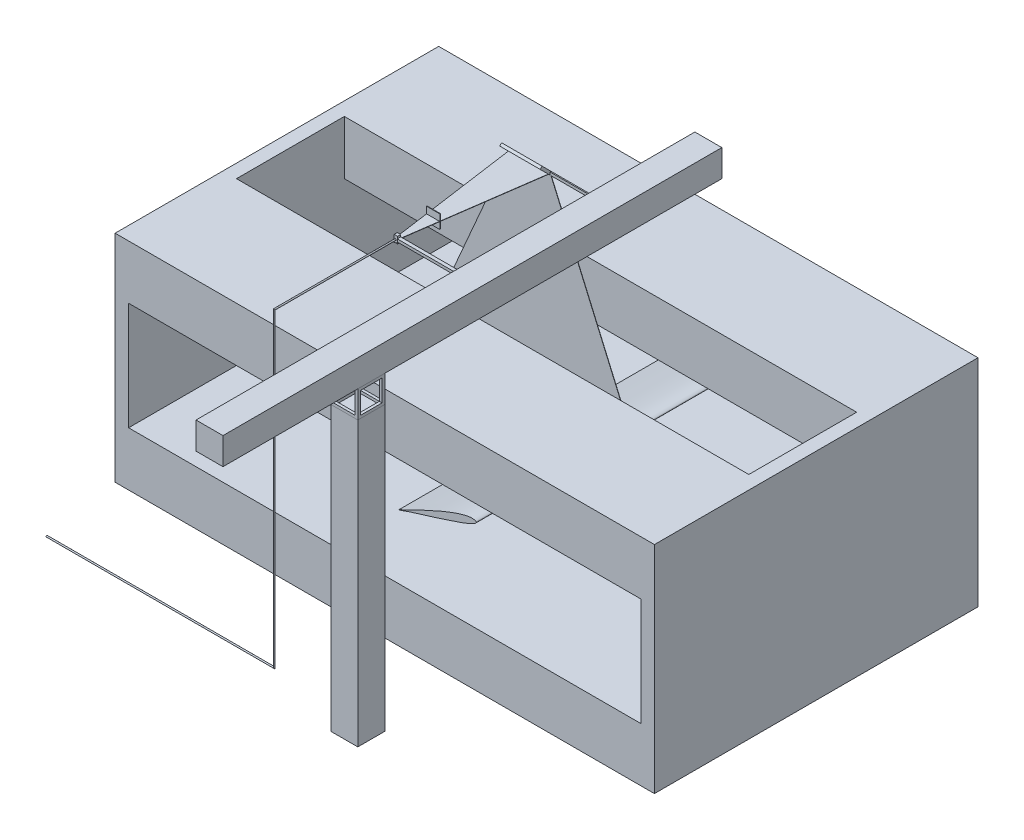
from build123d import *

# Parameters (mm, degrees)
SKETCH1_W                 = 2000
SKETCH1_H                 = 800
BOSS_EXTRUDE1_DEPTH       = 1200
CUT_EXTRUDE1_DEPTH        = 1613.45154966
CUT_EXTRUDE1_DEPTH_BACK   = 1613.45154966
SKETCH2_W                 = 1900
SKETCH2_H                 = 400
SKETCH3_W                 = 1900
SKETCH3_H                 = 400
CUT_EXTRUDE3_DEPTH        = 200
BOSS_EXTRUDE2_DEPTH       = 50
BOSS_EXTRUDE2_DEPTH_BACK  = 50
SKETCH5_W                 = 100
SKETCH5_H                 = 1050
SKETCH6_W                 = 100
SKETCH6_H                 = 100
SKETCH6_W_2               = 80
SKETCH6_H_2               = 80
BOSS_EXTRUDE3_DEPTH       = 100
CUT_EXTRUDE4_DEPTH        = 2031.394050425
CUT_EXTRUDE4_DEPTH_BACK   = 2031.394050425
SKETCH7_W                 = 80
SKETCH7_H                 = 80
CUT_EXTRUDE6_DEPTH        = 2137.000936329
CUT_EXTRUDE6_DEPTH_BACK   = 2137.000936329
SKETCH8_W                 = 80
SKETCH8_H                 = 80
SKETCH9_W                 = 1850
SKETCH9_H                 = 100
BOSS_EXTRUDE4_DEPTH       = 100
BOSS_EXTRUDE5_DEPTH       = 5
BOSS_EXTRUDE5_DEPTH_BACK  = 5
SKETCH12_W                = 150
SKETCH12_H                = 100
SKETCH13_R                = 2.5
SKETCH14_W                = 12.7
SKETCH14_H                = 25
BOSS_EXTRUDE6_DEPTH       = 12.7
CUT_EXTRUDE7_START        = -612.5
CUT_EXTRUDE7_DEPTH        = 612.5
BOSS_EXTRUDE7_DEPTH       = 0.5
BOSS_EXTRUDE7_DEPTH_BACK  = 0.5
BOSS_EXTRUDE9_REACH       = 2484.484
SKETCH18_W                = 4.142135624
SKETCH18_H                = 10
BOSS_EXTRUDE10_REACH      = 2500.535
SKETCH19_W                = 12.7
SKETCH19_H                = 10
AIRFOIL_DEPTH             = 500
AIRFOIL_DEPTH_BACK        = 500
BOSS_EXTRUDE12_DEPTH      = 1
BOSS_EXTRUDE12_DEPTH_BACK = 1
SKETCH22_W                = 50
SKETCH22_H                = 50
BOSS_EXTRUDE13_REACH      = 2513.917
LASERSHEET_DEPTH          = 0.5
LASERSHEET_DEPTH_BACK     = 0.5


with BuildPart() as part:
    # Sketch1 → Boss-Extrude1 (new body)
    with BuildSketch(Plane.XY):
        Rectangle(SKETCH1_W, SKETCH1_H)
    extrude(amount=BOSS_EXTRUDE1_DEPTH)

    # Sketch2 → Cut-Extrude1 (cut, two sides: drawn at the far end of the back side and taken through both)
    with BuildSketch(Plane.XY.offset(1200).offset(-CUT_EXTRUDE1_DEPTH_BACK)):
        Rectangle(SKETCH2_W, SKETCH2_H)
    extrude(amount=CUT_EXTRUDE1_DEPTH + CUT_EXTRUDE1_DEPTH_BACK, mode=Mode.SUBTRACT)

    # Sketch3 → Cut-Extrude3 (cut)
    with BuildSketch(Plane(origin=(0, 400, 0), x_dir=(1, 0, 0), z_dir=(0, 1, 0))):
        with Locations((0, -600)):
            Rectangle(SKETCH3_W, SKETCH3_H)
    extrude(amount=-CUT_EXTRUDE3_DEPTH, mode=Mode.SUBTRACT)


with BuildPart() as body_2:
    # Sketch5 → Boss-Extrude2 (new, two sides: drawn at the far end of the back side and taken through both)
    with BuildSketch(Plane.ZY.offset(-250).offset(-BOSS_EXTRUDE2_DEPTH_BACK)):
        with Locations((1550, 125)):
            Rectangle(SKETCH5_W, SKETCH5_H)
    extrude(amount=BOSS_EXTRUDE2_DEPTH + BOSS_EXTRUDE2_DEPTH_BACK)


with BuildPart() as body_3:
    # Sketch6 → Boss-Extrude3 (new body)
    with BuildSketch(Plane(origin=(0, 650, 0), x_dir=(1, 0, 0), z_dir=(0, 1, 0))):
        with Locations((250, -1550)):
            Rectangle(SKETCH6_W, SKETCH6_H)
        with Locations((250, -1550)):
            Rectangle(SKETCH6_W_2, SKETCH6_H_2, mode=Mode.SUBTRACT)
    extrude(amount=BOSS_EXTRUDE3_DEPTH)

    # Sketch7 → Cut-Extrude4 (cut, two sides: drawn at the far end of the back side and taken through both)
    with BuildSketch(Plane.XY.offset(1600).offset(-CUT_EXTRUDE4_DEPTH_BACK)):
        with Locations((250, 700)):
            Rectangle(SKETCH7_W, SKETCH7_H)
    extrude(amount=CUT_EXTRUDE4_DEPTH + CUT_EXTRUDE4_DEPTH_BACK, mode=Mode.SUBTRACT)

    # Sketch8 → Cut-Extrude6 (cut, two sides: drawn at the far end of the back side and taken through both)
    with BuildSketch(Plane.ZY.offset(-200).offset(-CUT_EXTRUDE6_DEPTH_BACK)):
        with Locations((1550, 700)):
            Rectangle(SKETCH8_W, SKETCH8_H)
    extrude(amount=CUT_EXTRUDE6_DEPTH + CUT_EXTRUDE6_DEPTH_BACK, mode=Mode.SUBTRACT)


with BuildPart() as body_4:
    # Sketch9 → Boss-Extrude4 (new body)
    with BuildSketch(Plane.ZY.offset(-200)):
        with Locations((1175, 800)):
            Rectangle(SKETCH9_W, SKETCH9_H)
    extrude(amount=-BOSS_EXTRUDE4_DEPTH)

    # Sketch18 → Boss-Extrude9 (add, up to next)
    with BuildSketch(Plane(origin=(15, 0, 0), x_dir=(0, 0, -1), z_dir=(1, 0, 0)), mode=Mode.PRIVATE) as boss_extrude9_sk1:
        with Locations((-600, 800)):
            Rectangle(SKETCH18_W, SKETCH18_H)
    boss_extrude9_tool1 = extrude(boss_extrude9_sk1.sketch, amount=BOSS_EXTRUDE9_REACH, mode=Mode.PRIVATE) - body_4.part


with BuildPart() as body_5:
    # Sketch12 → Boss-Extrude5 (new, two sides: drawn at the far end of the back side and taken through both)
    with BuildSketch(Plane(origin=(0, 100, -100), x_dir=(-1, 0, 0), z_dir=(2.6947018836624807e-15, 0.7071067811865488, -0.7071067811865464)).offset(-BOSS_EXTRUDE5_DEPTH_BACK)):
        with Locations((60, 989.949493661)):
            Rectangle(SKETCH12_W, SKETCH12_H)
    extrude(amount=BOSS_EXTRUDE5_DEPTH + BOSS_EXTRUDE5_DEPTH_BACK)



with BuildPart() as body_6:
    # LaserBeam: sweep along a curve in space
    with BuildLine() as laserbeam_path:
        Line((-903.860382838, -350, 1550), (-60, -350, 1550))
        Line((-60, -350, 1550), (-60, 800, 1550))
        Line((-60, 800, 1550), (-60, 800, 1100))
    # Sketch13 → LaserBeam (sweep)
    with BuildSketch(Plane.ZY.offset(903.860382838)):
        with Locations((1550, -350)):
            Circle(SKETCH13_R)
    sweep(path=laserbeam_path.line, transition=Transition.RIGHT)


with BuildPart() as body_7:
    # Sketch14 → Boss-Extrude6 (new body)
    with BuildSketch(Plane(origin=(0, 0, 1100), x_dir=(-1, 0, 0), z_dir=(0, 0, -1))):
        with Locations((60, 800)):
            Rectangle(SKETCH14_W, SKETCH14_H)
    extrude(amount=BOSS_EXTRUDE6_DEPTH)


with BuildPart() as cut_extrude7_tool:
    # Sketch15 → Cut-Extrude7 (new body)
    with BuildSketch(Plane(origin=(0, 812.5, 0), x_dir=(1, 0, 0), z_dir=(0, 1, 0)).offset(CUT_EXTRUDE7_START)):
        with BuildLine():
            Line((-66.35, -1100), (-53.65, -1100))
            ThreePointArc((-53.65, -1100), (-60, -1098.26696336), (-66.35, -1100))
        make_face()
    extrude(amount=CUT_EXTRUDE7_DEPTH)


with BuildPart() as part_1:
    add(part.part)

    # Cut-Extrude7: cut by cut_extrude7_tool
    add(cut_extrude7_tool.part, mode=Mode.SUBTRACT)


with BuildPart() as body_7_1:
    add(body_7.part)

    # Cut-Extrude7: cut by cut_extrude7_tool
    add(cut_extrude7_tool.part, mode=Mode.SUBTRACT)


with BuildPart() as body_5_1:
    add(body_5.part)

    add(body_7_1.part)  # Boss-Extrude7 merges body 7
    # Sketch16 → Boss-Extrude7 (add, two sides: drawn at the far end of the back side and taken through both)
    with BuildSketch(Plane(origin=(0, 800, 0), x_dir=(1, 0, 0), z_dir=(0, 1, 0)).offset(-BOSS_EXTRUDE7_DEPTH_BACK)):
        Polygon((-53.65, -1087.3), (15, -600), (-135, -600), (-66.35, -1087.3), align=None)
    extrude(amount=BOSS_EXTRUDE7_DEPTH + BOSS_EXTRUDE7_DEPTH_BACK)


with BuildPart() as body_4_1:
    add(body_4.part)

    add(body_5_1.part)  # Boss-Extrude9 merges body 5
    add(boss_extrude9_tool1.solids().sort_by_distance((15, 800, 600))[0])

    # Sketch19 → Boss-Extrude10 (add, up to next)
    with BuildSketch(Plane(origin=(-53.65, 0, 0), x_dir=(0, 0, -1), z_dir=(1, 0, 0)), mode=Mode.PRIVATE) as boss_extrude10_sk1:
        with Locations((-1093.65, 800)):
            Rectangle(SKETCH19_W, SKETCH19_H)
    boss_extrude10_tool1 = extrude(boss_extrude10_sk1.sketch, amount=BOSS_EXTRUDE10_REACH, mode=Mode.PRIVATE) - body_4_1.part
    add(boss_extrude10_tool1.solids().sort_by_distance((-53.65, 800, 1093.65))[0])

    # Sketch22 → Boss-Extrude12 (add, two sides: drawn at the far end of the back side and taken through both)
    with BuildSketch(Plane(origin=(0, 0, 960), x_dir=(-1, 0, 0), z_dir=(0, 0, -1)).offset(-BOSS_EXTRUDE12_DEPTH_BACK)):
        with Locations((60, 800)):
            Rectangle(SKETCH22_W, SKETCH22_H)
    extrude(amount=BOSS_EXTRUDE12_DEPTH + BOSS_EXTRUDE12_DEPTH_BACK)

    # Boss-Extrude13: up to this face of the body (flat: up to its plane)
    boss_extrude13_end = Plane(body_4_1.part.faces().sort_by_distance((-35, 800, 960))[0])
    # Sketch23 → Boss-Extrude13 (add, up to the picked face)
    with BuildSketch(Plane.ZY.offset(85), mode=Mode.PRIVATE) as boss_extrude13_sk1:
        with BuildLine():
            Line((959, 775), (961, 775))
            Line((961, 775), (961, 825))
            Line((961, 825), (959, 825))
            ThreePointArc((959, 825), (958.374608886, 800), (959, 775))
        make_face()
    boss_extrude13_tool1 = split(extrude(boss_extrude13_sk1.sketch, amount=-BOSS_EXTRUDE13_REACH, mode=Mode.PRIVATE), bisect_by=boss_extrude13_end, keep=Keep.BOTH, mode=Mode.PRIVATE)
    add(boss_extrude13_tool1.solids().sort_by(Axis((-85, 800, 959.78432), (1, 0, 0)))[0])

    # Sketch17 → LaserSheet (add, two sides: drawn at the far end of the back side and taken through both)
    with BuildSketch(Plane(origin=(0, 0, 600), x_dir=(-1, 0, 0), z_dir=(0, 0, -1)).offset(-LASERSHEET_DEPTH_BACK)):
        with BuildLine():
            Line((133.933400769, 800.5), (508.839441835, -61.72486446))
            Line((508.839441835, -61.72486446), (47.385060442, -61.72486446))
            add(Edge.make_bspline(
                [(47.385060442, -61.72486446), (47.050272534, -61.564410009), (46.107406627, -61.112520833), (44.458183013, -60.30789275), (42.360074972, -59.260036028), (40.029813741, -58.086381187), (37.54074774, -56.836964134), (34.962706586, -55.551979936), (32.336920423, -54.255559985), (29.680464013, -52.954908848), (26.999348938, -51.649401023), (24.299180792, -50.339870771), (21.586595234, -49.027959907), (18.867199146, -47.714955318), (16.144401156, -46.402072077), (13.420361926, -45.089250406), (10.695170551, -43.777935507), (7.968996718, -42.467543111), (5.241683287, -41.157442217), (2.512521556, -39.848362096), (-0.217897093, -38.539281404), (-2.94880462, -37.230679489), (-5.679474287, -35.923168979), (-8.409018378, -34.616837414), (-11.137841917, -33.312576932), (-13.866050804, -32.009974052), (-16.594853457, -30.709212324), (-19.324876608, -29.409918097), (-22.055999824, -28.110637757), (-24.788699713, -26.81303557), (-27.521801261, -25.515839779), (-30.254892613, -24.220068847), (-32.987201706, -22.926071919), (-35.718769129, -21.634710072), (-38.449379994, -20.346047514), (-41.179247493, -19.059629838), (-43.909026325, -17.776414889), (-46.639114265, -16.496084151), (-49.369311648, -15.217992595), (-52.100351667, -13.943230006), (-54.831677743, -12.670906715), (-57.563700082, -11.402162702), (-60.29618319, -10.136775428), (-63.028863014, -8.874694342), (-65.762092565, -7.616947282), (-68.495325828, -6.362873921), (-71.228628995, -5.112896059), (-73.962495931, -3.867892818), (-76.696521093, -2.627030877), (-79.431548244, -1.391205964), (-82.167655029, -0.160138117), (-84.905269743, 1.066208092), (-87.644421251, 2.288232443), (-90.385678647, 3.504654974), (-93.12834275, 4.716780769), (-95.872005002, 5.9237704), (-98.61654308, 7.124603757), (-101.360941697, 8.320022119), (-104.105560781, 9.508393941), (-106.850233176, 10.689768832), (-109.595204446, 11.863791341), (-112.341109893, 13.03023375), (-115.088179843, 14.189554057), (-117.837097231, 15.340891585), (-120.587787516, 16.484390836), (-123.33980178, 17.620313968), (-126.093227168, 18.746825652), (-128.847129897, 19.864820638), (-131.601391587, 20.973215898), (-134.35627166, 22.071037184), (-137.111714943, 23.157827564), (-139.867542289, 24.234298149), (-142.624731133, 25.298196425), (-145.382648527, 26.351126554), (-148.142138407, 27.390583506), (-150.902252185, 28.417905707), (-153.663265559, 29.43119256), (-156.424346326, 30.430641685), (-159.185547663, 31.414331229), (-161.946555277, 32.381619674), (-164.706762673, 33.332440554), (-167.466316746, 34.264849212), (-170.224577725, 35.178590205), (-172.981701748, 36.0720017), (-175.737321047, 36.943995764), (-178.49087827, 37.794146188), (-181.24205225, 38.620264393), (-183.989783104, 39.420816032), (-186.732776295, 40.194348246), (-189.469102673, 40.939151917), (-192.197288429, 41.652324134), (-194.915121459, 42.331422814), (-197.620728311, 42.973429096), (-200.311396309, 43.576383932), (-202.984694277, 44.136315464), (-205.637532078, 44.649694089), (-208.265200424, 45.114194466), (-210.860806242, 45.524150268), (-213.413146872, 45.87428722), (-215.907560809, 46.162033205), (-218.328043171, 46.380353893), (-220.658773681, 46.525317083), (-222.881443681, 46.596530738), (-224.970584364, 46.593833673), (-226.895408107, 46.520550978), (-228.630505784, 46.391265956), (-230.166766579, 46.213031106), (-231.511850363, 45.995905214), (-232.684887697, 45.753251804), (-233.705802724, 45.49367685), (-234.592358145, 45.225015402), (-235.36013503, 44.953804198), (-236.026013687, 44.686482504), (-236.605472175, 44.424568054), (-237.109097981, 44.160387065), (-237.54682703, 43.890408704), (-237.928016568, 43.613061545), (-238.260421857, 43.327896599), (-238.549962753, 43.03665837), (-238.798557417, 42.741435502), (-239.005303384, 42.444036265), (-239.168313381, 42.144890235), (-239.256602903, 41.918381696), (-239.29248904, 41.793618832), (-239.2984074, 41.771651285)],
                knots=[0, 0, 0, 0, 0.001804225, 0.005081255, 0.008917832, 0.01320152, 0.017761229, 0.02245269, 0.027200414, 0.031992676, 0.036826985, 0.041692761, 0.046576852, 0.051470519, 0.05636841, 0.061267135, 0.066166105, 0.071065863, 0.075966949, 0.080870298, 0.085776007, 0.090682602, 0.095587087, 0.100489462, 0.105388649, 0.110285632, 0.11518184, 0.120079778, 0.124979051, 0.129880056, 0.134781414, 0.139681603, 0.144579596, 0.149473826, 0.154365279, 0.159253466, 0.164139775, 0.169024209, 0.1739078, 0.178789972, 0.183671265, 0.188551107, 0.19342901, 0.198305472, 0.203179435, 0.208050946, 0.212919972, 0.217785952, 0.222649919, 0.227511316, 0.232371631, 0.237230879, 0.242089564, 0.246948123, 0.251805655, 0.256662138, 0.261515061, 0.266364472, 0.271209804, 0.276050065, 0.280886237, 0.285718813, 0.290548806, 0.295376693, 0.300202506, 0.305025785, 0.30984552, 0.31466029, 0.3194701, 0.324273963, 0.329072413, 0.333865015, 0.338652282, 0.343434787, 0.34821159, 0.35298278, 0.357747446, 0.362504696, 0.367253161, 0.371992479, 0.376722293, 0.381440811, 0.38614822, 0.390843284, 0.39552577, 0.400194468, 0.40484828, 0.409485639, 0.414103033, 0.418698511, 0.423267334, 0.427806837, 0.432312512, 0.436780905, 0.441206952, 0.445585735, 0.449911912, 0.454174342, 0.458355503, 0.462431139, 0.466376098, 0.47016501, 0.473778403, 0.477181674, 0.480315733, 0.483137436, 0.485635283, 0.487829401, 0.489756771, 0.491454839, 0.492946996, 0.494257213, 0.495410773, 0.496433169, 0.497346323, 0.49817267, 0.498930307, 0.499634923, 0.500298857, 0.500923998, 0.501508231, 0.502056218, 0.502575777, 0.502686192, 0.502686192, 0.502686192, 0.502686192], degree=3))
            Line((-239.2984074, 41.771651285), (-267.181794101, -61.72486446))
            Line((-267.181794101, -61.72486446), (-388.839441835, -61.72486446))
            Line((-388.839441835, -61.72486446), (-13.933400769, 800.5))
            Line((-13.933400769, 800.5), (133.933400769, 800.5))
        make_face()
    extrude(amount=LASERSHEET_DEPTH + LASERSHEET_DEPTH_BACK)


with BuildPart() as body_6_2:
    # Sketch20 → Airfoil (new, two sides: drawn at the far end of the back side and taken through both)
    with BuildSketch(Plane(origin=(0, 0, 600), x_dir=(-1, 0, 0), z_dir=(0, 0, -1)).offset(-AIRFOIL_DEPTH_BACK)):
        with BuildLine():
            Line((47.038514266, -62.676992253), (47.385060442, -61.72486446))
            add(Edge.make_bspline(
                [(47.385060442, -61.72486446), (47.050272534, -61.564410009), (46.107406627, -61.112520833), (44.458183013, -60.30789275), (42.360074972, -59.260036028), (40.029813741, -58.086381187), (37.54074774, -56.836964134), (34.962706586, -55.551979936), (32.336920423, -54.255559985), (29.680464013, -52.954908848), (26.999348938, -51.649401023), (24.299180792, -50.339870771), (21.586595234, -49.027959907), (18.867199146, -47.714955318), (16.144401156, -46.402072077), (13.420361926, -45.089250406), (10.695170551, -43.777935507), (7.968996718, -42.467543111), (5.241683287, -41.157442217), (2.512521556, -39.848362096), (-0.217897093, -38.539281404), (-2.94880462, -37.230679489), (-5.679474287, -35.923168979), (-8.409018378, -34.616837414), (-11.137841917, -33.312576932), (-13.866050804, -32.009974052), (-16.594853457, -30.709212324), (-19.324876608, -29.409918097), (-22.055999824, -28.110637757), (-24.788699713, -26.81303557), (-27.521801261, -25.515839779), (-30.254892613, -24.220068847), (-32.987201706, -22.926071919), (-35.718769129, -21.634710072), (-38.449379994, -20.346047514), (-41.179247493, -19.059629838), (-43.909026325, -17.776414889), (-46.639114265, -16.496084151), (-49.369311648, -15.217992595), (-52.100351667, -13.943230006), (-54.831677743, -12.670906715), (-57.563700082, -11.402162702), (-60.29618319, -10.136775428), (-63.028863014, -8.874694342), (-65.762092565, -7.616947282), (-68.495325828, -6.362873921), (-71.228628995, -5.112896059), (-73.962495931, -3.867892818), (-76.696521093, -2.627030877), (-79.431548244, -1.391205964), (-82.167655029, -0.160138117), (-84.905269743, 1.066208092), (-87.644421251, 2.288232443), (-90.385678647, 3.504654974), (-93.12834275, 4.716780769), (-95.872005002, 5.9237704), (-98.61654308, 7.124603757), (-101.360941697, 8.320022119), (-104.105560781, 9.508393941), (-106.850233176, 10.689768832), (-109.595204446, 11.863791341), (-112.341109893, 13.03023375), (-115.088179843, 14.189554057), (-117.837097231, 15.340891585), (-120.587787516, 16.484390836), (-123.33980178, 17.620313968), (-126.093227168, 18.746825652), (-128.847129897, 19.864820638), (-131.601391587, 20.973215898), (-134.35627166, 22.071037184), (-137.111714943, 23.157827564), (-139.867542289, 24.234298149), (-142.624731133, 25.298196425), (-145.382648527, 26.351126554), (-148.142138407, 27.390583506), (-150.902252185, 28.417905707), (-153.663265559, 29.43119256), (-156.424346326, 30.430641685), (-159.185547663, 31.414331229), (-161.946555277, 32.381619674), (-164.706762673, 33.332440554), (-167.466316746, 34.264849212), (-170.224577725, 35.178590205), (-172.981701748, 36.0720017), (-175.737321047, 36.943995764), (-178.49087827, 37.794146188), (-181.24205225, 38.620264393), (-183.989783104, 39.420816032), (-186.732776295, 40.194348246), (-189.469102673, 40.939151917), (-192.197288429, 41.652324134), (-194.915121459, 42.331422814), (-197.620728311, 42.973429096), (-200.311396309, 43.576383932), (-202.984694277, 44.136315464), (-205.637532078, 44.649694089), (-208.265200424, 45.114194466), (-210.860806242, 45.524150268), (-213.413146872, 45.87428722), (-215.907560809, 46.162033205), (-218.328043171, 46.380353893), (-220.658773681, 46.525317083), (-222.881443681, 46.596530738), (-224.970584364, 46.593833673), (-226.895408107, 46.520550978), (-228.630505784, 46.391265956), (-230.166766579, 46.213031106), (-231.511850363, 45.995905214), (-232.684887697, 45.753251804), (-233.705802724, 45.49367685), (-234.592358145, 45.225015402), (-235.36013503, 44.953804198), (-236.026013687, 44.686482504), (-236.605472175, 44.424568054), (-237.109097981, 44.160387065), (-237.54682703, 43.890408704), (-237.928016568, 43.613061545), (-238.260421857, 43.327896599), (-238.549962753, 43.03665837), (-238.798557417, 42.741435502), (-239.005303384, 42.444036265), (-239.168313381, 42.144890235), (-239.285998761, 41.84296603), (-239.35580958, 41.535409681), (-239.368514069, 41.218967847), (-239.328121548, 40.891770775), (-239.236584887, 40.548424061), (-239.093089569, 40.182783633), (-238.894953917, 39.789206864), (-238.64138318, 39.362521305), (-238.331354566, 38.896895979), (-237.952485817, 38.394922473), (-237.496164457, 37.858961824), (-236.955102084, 37.293711645), (-236.325935341, 36.694897627), (-235.59561449, 36.051803984), (-234.735021139, 35.350118497), (-233.70141353, 34.572721534), (-232.451444457, 33.702326908), (-230.955553662, 32.739552998), (-229.220878024, 31.706563025), (-227.28327185, 30.627498906), (-225.18160234, 29.514201772), (-222.934818962, 28.381171414), (-220.564448777, 27.233642271), (-218.098554096, 26.08140915), (-215.565421417, 24.935780944), (-212.986622403, 23.80290853), (-210.373792651, 22.683851804), (-207.731419521, 21.577507556), (-205.061920793, 20.483066336), (-202.368831639, 19.400006909), (-199.656769983, 18.327021677), (-196.928944773, 17.265262565), (-194.187800479, 16.214849254), (-191.435276851, 15.173779225), (-188.671645087, 14.142138776), (-185.897437603, 13.119074672), (-183.113468947, 12.10323868), (-180.320462569, 11.094718566), (-177.519484188, 10.092356898), (-174.711233305, 9.096931036), (-171.897067987, 8.106438249), (-169.076941367, 7.122563876), (-166.25197878, 6.143342918), (-163.422373266, 5.168847323), (-160.588278504, 4.199597924), (-157.75037832, 3.233917392), (-154.908432096, 2.273177472), (-152.063042725, 1.315613559), (-149.214220173, 0.36185842), (-146.362136207, -0.58858105), (-143.507259996, -1.535801877), (-140.649833439, -2.480194184), (-137.790123793, -3.421240702), (-134.928519679, -4.360113486), (-132.065122274, -5.29579843), (-129.200235961, -6.228897532), (-126.334028407, -7.159260985), (-123.466351034, -8.086746015), (-120.59753202, -9.012039413), (-117.72717268, -9.934209169), (-114.855718126, -10.854640336), (-111.982844667, -11.772298054), (-109.108847987, -12.688120857), (-106.233328138, -13.601159748), (-103.356601954, -14.512746847), (-100.478436766, -15.422136641), (-97.599010611, -16.329200272), (-94.718645847, -17.234947202), (-91.837336977, -18.138670014), (-88.955176017, -19.040320556), (-86.07243475, -19.940428622), (-83.189131621, -20.83837299), (-80.305197258, -21.734287392), (-77.420800892, -22.628015241), (-74.535987729, -23.520028511), (-71.650654863, -24.410339514), (-68.764585151, -25.298605944), (-65.877470161, -26.184858723), (-62.989280381, -27.069675569), (-60.099603015, -27.953077765), (-57.208138695, -28.835108265), (-54.31491248, -29.716159441), (-51.420159893, -30.596620141), (-48.524066946, -31.475998925), (-45.627359557, -32.355251555), (-42.730292514, -33.233744324), (-39.833508967, -34.112123131), (-36.937669682, -34.991091867), (-34.04278778, -35.869900724), (-31.149884672, -36.750110069), (-28.258830779, -37.630851237), (-25.370401309, -38.513239234), (-22.484479512, -39.396835247), (-19.601370343, -40.281891242), (-16.721467652, -41.169289207), (-13.844640183, -42.058534154), (-10.971099142, -42.950604487), (-8.100745041, -43.845811266), (-5.233154113, -44.744127643), (-2.368343633, -45.645906063), (0.493511803, -46.551991941), (3.351711723, -47.461861866), (6.205481568, -48.375568998), (9.053577739, -49.293262201), (11.895025778, -50.215901824), (14.729272391, -51.143139082), (17.555731516, -52.076043931), (20.37355213, -53.015163877), (23.180717942, -53.961011442), (25.974153511, -54.912462831), (28.748485796, -55.870101143), (31.497603872, -56.833174183), (34.210896838, -57.799041649), (36.86547902, -58.760788891), (39.419084319, -59.705005591), (41.810145183, -60.608093172), (43.968132214, -61.445302803), (45.68389367, -62.129221944), (46.673561917, -62.529415831), (47.038514266, -62.676992253)],
                knots=[0, 0, 0, 0, 0.001804225, 0.005081255, 0.008917832, 0.01320152, 0.017761229, 0.02245269, 0.027200414, 0.031992676, 0.036826985, 0.041692761, 0.046576852, 0.051470519, 0.05636841, 0.061267135, 0.066166105, 0.071065863, 0.075966949, 0.080870298, 0.085776007, 0.090682602, 0.095587087, 0.100489462, 0.105388649, 0.110285632, 0.11518184, 0.120079778, 0.124979051, 0.129880056, 0.134781414, 0.139681603, 0.144579596, 0.149473826, 0.154365279, 0.159253466, 0.164139775, 0.169024209, 0.1739078, 0.178789972, 0.183671265, 0.188551107, 0.19342901, 0.198305472, 0.203179435, 0.208050946, 0.212919972, 0.217785952, 0.222649919, 0.227511316, 0.232371631, 0.237230879, 0.242089564, 0.246948123, 0.251805655, 0.256662138, 0.261515061, 0.266364472, 0.271209804, 0.276050065, 0.280886237, 0.285718813, 0.290548806, 0.295376693, 0.300202506, 0.305025785, 0.30984552, 0.31466029, 0.3194701, 0.324273963, 0.329072413, 0.333865015, 0.338652282, 0.343434787, 0.34821159, 0.35298278, 0.357747446, 0.362504696, 0.367253161, 0.371992479, 0.376722293, 0.381440811, 0.38614822, 0.390843284, 0.39552577, 0.400194468, 0.40484828, 0.409485639, 0.414103033, 0.418698511, 0.423267334, 0.427806837, 0.432312512, 0.436780905, 0.441206952, 0.445585735, 0.449911912, 0.454174342, 0.458355503, 0.462431139, 0.466376098, 0.47016501, 0.473778403, 0.477181674, 0.480315733, 0.483137436, 0.485635283, 0.487829401, 0.489756771, 0.491454839, 0.492946996, 0.494257213, 0.495410773, 0.496433169, 0.497346323, 0.49817267, 0.498930307, 0.499634923, 0.500298857, 0.500923998, 0.501508231, 0.502056218, 0.502575777, 0.503078393, 0.503581586, 0.504106728, 0.504674749, 0.505303996, 0.506012322, 0.506813826, 0.507714848, 0.508729614, 0.509868338, 0.511133714, 0.512530459, 0.514088315, 0.515861753, 0.517925458, 0.52037215, 0.52326244, 0.526568906, 0.530182171, 0.534039585, 0.53812642, 0.542410289, 0.546837655, 0.551353613, 0.555921044, 0.560525954, 0.565166974, 0.569842555, 0.57454713, 0.579273593, 0.584016693, 0.588772649, 0.593539648, 0.598318286, 0.603108657, 0.607909355, 0.612720435, 0.617539966, 0.622366999, 0.62720007, 0.632038721, 0.636882457, 0.641730305, 0.646582779, 0.651438879, 0.656298631, 0.661162014, 0.666029039, 0.670898717, 0.67577203, 0.680646997, 0.685524119, 0.690402878, 0.695283295, 0.700163878, 0.705045619, 0.70992803, 0.714811098, 0.719694844, 0.72457973, 0.729465284, 0.734351491, 0.739238866, 0.744127374, 0.749017036, 0.753907856, 0.758798807, 0.7636909, 0.76858315, 0.773475043, 0.778367591, 0.783259317, 0.788151209, 0.793042753, 0.79793395, 0.802825814, 0.807717853, 0.812611031, 0.817505843, 0.822402783, 0.82730232, 0.832203935, 0.837107137, 0.842011377, 0.846915672, 0.851819474, 0.856722235, 0.861622971, 0.866522094, 0.871417634, 0.876310525, 0.881199784, 0.886085387, 0.890967288, 0.895844998, 0.900718967, 0.905589673, 0.910457123, 0.915322785, 0.920185637, 0.925045694, 0.929899988, 0.934748002, 0.939587727, 0.944418676, 0.949240338, 0.954052702, 0.958853308, 0.963636259, 0.968394157, 0.973116681, 0.97779256, 0.982390802, 0.986838, 0.991023752, 0.994812032, 0.998086873, 1, 1, 1, 1], degree=3))
        make_face()
    extrude(amount=AIRFOIL_DEPTH + AIRFOIL_DEPTH_BACK)


solid = Compound([body_2.part, body_3.part, body_6.part, part_1.part, body_4_1.part, body_6_2.part])
